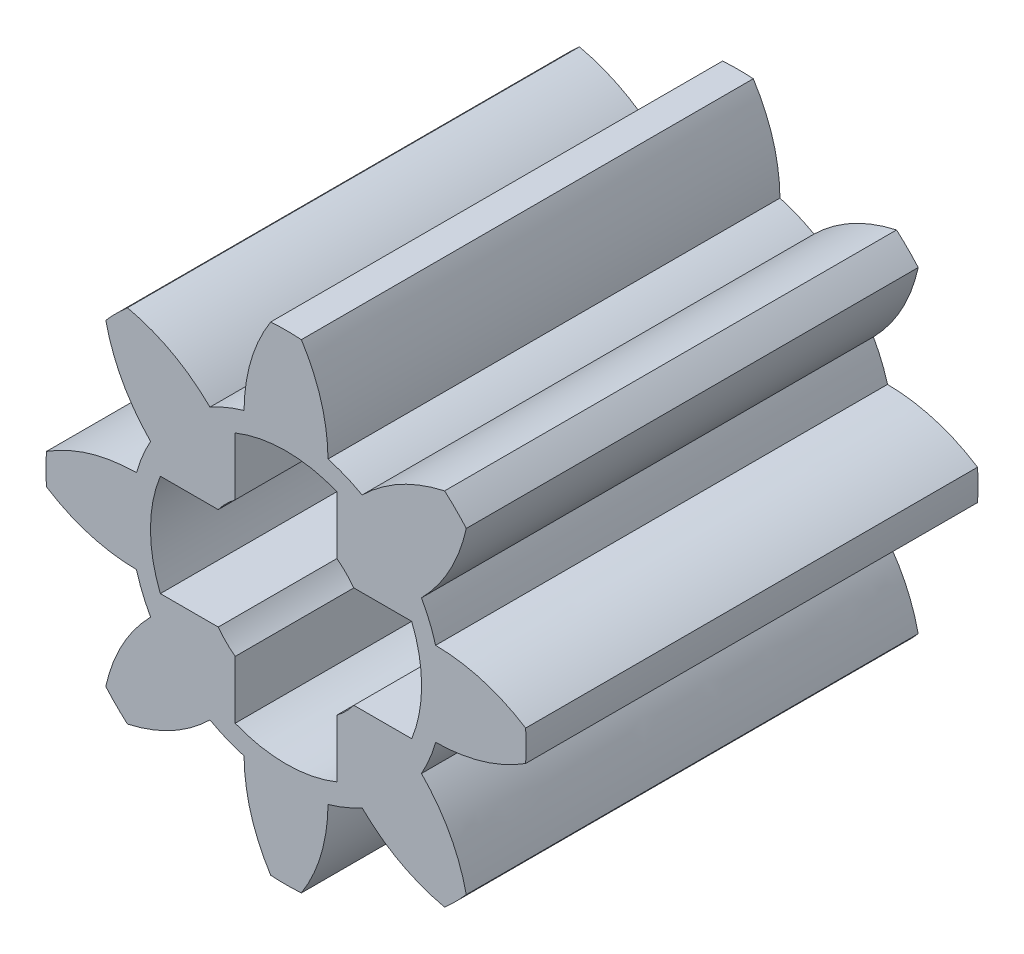
from build123d import *

# Parameters (mm, degrees)
SKETCH1_R           = 2.75
SKETCH1_R_2         = 1.5
BOSS_EXTRUDE1_DEPTH = 8
BOSS_EXTRUDE2_START = -8
BOSS_EXTRUDE2_DEPTH = 8
CIRPATTERN2_COUNT   = 8
CUT_EXTRUDE1_DEPTH  = 10


with BuildPart() as part:
    # Sketch1 → Boss-Extrude1 (new body)
    with BuildSketch(Plane.XY):
        Circle(SKETCH1_R)
        Circle(SKETCH1_R_2, mode=Mode.SUBTRACT)
    extrude(amount=BOSS_EXTRUDE1_DEPTH)

    # Sketch3 → Boss-Extrude2 (add)
    with BuildSketch(Plane.XY.offset(8).offset(BOSS_EXTRUDE2_START)):
        with BuildLine():
            ThreePointArc((0.743305991, 2.647639742), (0, 2.75), (-0.743305991, 2.647639742))
            add(Edge.make_bspline(
                [(-0.271475541, 4.241320671), (-0.733052657, 3.513929186), (-0.743305991, 2.647639742)],
                knots=[0, 0, 0, 1, 1, 1], degree=2))
            ThreePointArc((-0.271475541, 4.241320671), (0, 4.25), (0.271475541, 4.241320671))
            add(Edge.make_bspline(
                [(0.271475541, 4.241320671), (0.733052657, 3.513929186), (0.743305991, 2.647639742)],
                knots=[0, 0, 0, 1, 1, 1], degree=2))
        make_face()
    boss_extrude2 = extrude(amount=BOSS_EXTRUDE2_DEPTH)

    # CirPattern2: Boss-Extrude2 ×8 about axis
    cirpattern2_axis = Axis((0, 0, 8), (0, 0, -1))
    for i in range(1, CIRPATTERN2_COUNT):
        add(boss_extrude2.rotate(cirpattern2_axis, i * 360 / CIRPATTERN2_COUNT))

    # Sketch4 → Cut-Extrude1 (cut)
    with BuildSketch(Plane.XY.offset(8)):
        with BuildLine():
            Line((-0.9, 2.224859546), (-0.9, 0.9))
            Line((-0.9, 0.9), (-2.224859546, 0.9))
            ThreePointArc((-2.224859546, 0.9), (-2.4, 0), (-2.224859546, -0.9))
            Line((-2.224859546, -0.9), (-0.9, -0.9))
            Line((-0.9, -0.9), (-0.9, -2.224859546))
            ThreePointArc((-0.9, -2.224859546), (0, -2.4), (0.9, -2.224859546))
            Line((0.9, -2.224859546), (0.9, -0.9))
            Line((0.9, -0.9), (2.224859546, -0.9))
            ThreePointArc((2.224859546, -0.9), (2.4, 0), (2.224859546, 0.9))
            Line((2.224859546, 0.9), (0.9, 0.9))
            Line((0.9, 0.9), (0.9, 2.224859546))
            ThreePointArc((0.9, 2.224859546), (0, 2.4), (-0.9, 2.224859546))
        make_face()
    extrude(amount=-CUT_EXTRUDE1_DEPTH, mode=Mode.SUBTRACT)


solid = part.part
